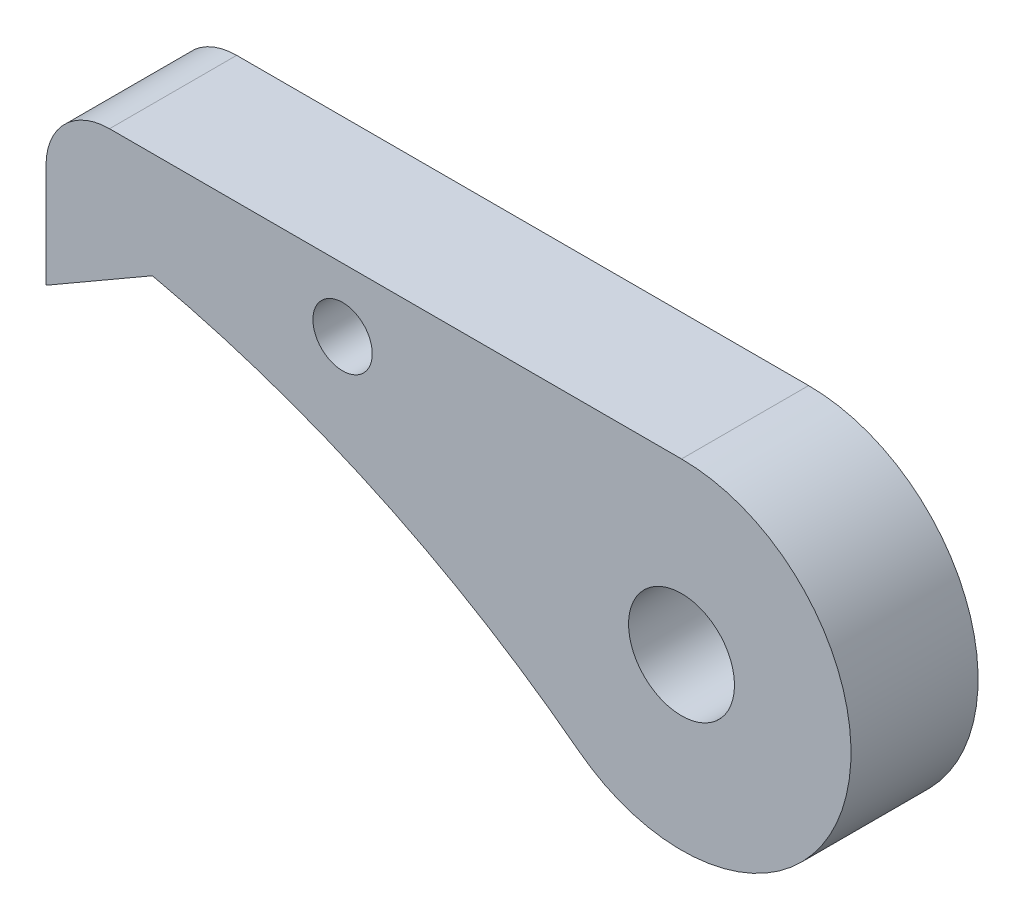
from build123d import *

# Parameters (mm, degrees)
SKETCH1_R           = 2.5
BOSS_EXTRUDE1_DEPTH = 3
SKETCH2_R           = 1.4
CUT_EXTRUDE1_DEPTH  = 10


with BuildPart() as part:
    # Sketch1 → Boss-Extrude1 (new, symmetric)
    with BuildSketch(Plane.XY):
        with BuildLine():
            Line((0, 8), (-27, 8))
            ThreePointArc((-27, 8), (-29.121320344, 7.121320344), (-30, 5))
            Line((-30, 5), (-30, 0.1))
            Line((-30, 0.1), (-24.977052658, 3))
            ThreePointArc((-24.977052658, 3), (-14.406610269, -0.585971857), (-4.85358477, -6.359458694))
            ThreePointArc((-4.85358477, -6.359458694), (7.578775282, -2.561672349), (0, 8))
        make_face()
        Circle(SKETCH1_R, mode=Mode.SUBTRACT)
    extrude(amount=BOSS_EXTRUDE1_DEPTH, both=True)

    # Sketch2 → Cut-Extrude1 (cut)
    with BuildSketch(Plane.XY.offset(3)):
        with Locations((-16, 5)):
            Circle(SKETCH2_R)
    extrude(amount=-CUT_EXTRUDE1_DEPTH, mode=Mode.SUBTRACT)


solid = part.part
